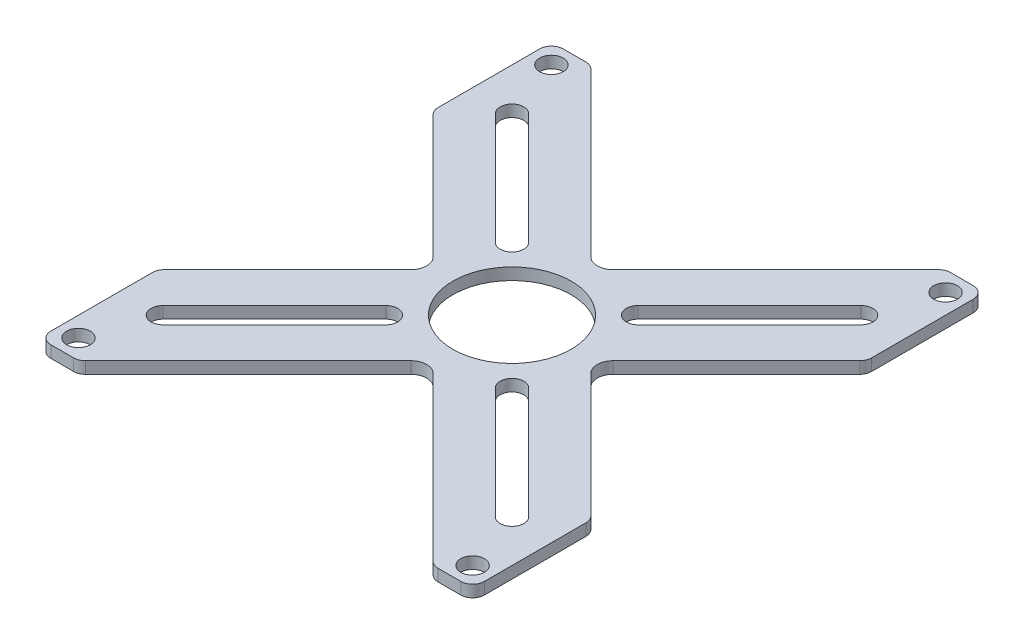
from build123d import *

# Parameters (mm, degrees)
SKETCH_1_W          = 55
SKETCH_1_H          = 65
SKETCH_1_R          = 1.5
EXTRUDE_1_DEPTH     = 1.5
CUT_EXTRUDE_1_DEPTH = 1.5
SKETCH_3_R          = 7.5
CUT_EXTRUDE_2_DEPTH = 43.599882629
FILLET_1_R          = 2
FILLET_2_R          = 1.5


with BuildPart() as part:
    # 草图1 → 凸台-拉伸1 (new body)
    with BuildSketch(Plane(origin=(0, 0, 0), x_dir=(1, 0, 0), z_dir=(0, 1, 0))):
        Rectangle(SKETCH_1_W, SKETCH_1_H)
        with Locations(Location((-25, 30, 0), (0, 0, 270))):
            Circle(SKETCH_1_R, mode=Mode.SUBTRACT)
        with Locations(Location((25, 30, 0), (0, 0, 270))):
            Circle(SKETCH_1_R, mode=Mode.SUBTRACT)
        with Locations(Location((25, -30, 0), (0, 0, 270))):
            Circle(SKETCH_1_R, mode=Mode.SUBTRACT)
        with Locations(Location((-25, -30, 0), (0, 0, 270))):
            Circle(SKETCH_1_R, mode=Mode.SUBTRACT)
    extrude(amount=EXTRUDE_1_DEPTH)

    # 草图2 → 切除-拉伸1 (cut)
    with BuildSketch(Plane(origin=(0, 1.5, 0), x_dir=(1, 0, 0), z_dir=(0, 1, 0))):
        with BuildLine():
            Line((-21.081475452, 23.202795796), (-6.939339828, 9.060660172))
            ThreePointArc((-6.939339828, 9.060660172), (-6.939339828, 6.939339828), (-9.060660172, 6.939339828))
            Line((-9.060660172, 6.939339828), (-23.202795796, 21.081475452))
            ThreePointArc((-23.202795796, 21.081475452), (-23.202795796, 23.202795796), (-21.081475452, 23.202795796))
        make_face()
        with BuildLine():
            Line((21.081475452, 23.202795796), (6.939339828, 9.060660172))
            ThreePointArc((6.939339828, 9.060660172), (6.939339828, 6.939339828), (9.060660172, 6.939339828))
            Line((9.060660172, 6.939339828), (23.202795796, 21.081475452))
            ThreePointArc((23.202795796, 21.081475452), (23.202795796, 23.202795796), (21.081475452, 23.202795796))
        make_face()
        with BuildLine():
            Line((23.202795796, -21.081475452), (9.060660172, -6.939339828))
            ThreePointArc((9.060660172, -6.939339828), (6.939339828, -6.939339828), (6.939339828, -9.060660172))
            Line((6.939339828, -9.060660172), (21.081475452, -23.202795796))
            ThreePointArc((21.081475452, -23.202795796), (23.202795796, -23.202795796), (23.202795796, -21.081475452))
        make_face()
        with BuildLine():
            Line((-21.081475452, -23.202795796), (-6.939339828, -9.060660172))
            ThreePointArc((-6.939339828, -9.060660172), (-6.939339828, -6.939339828), (-9.060660172, -6.939339828))
            Line((-9.060660172, -6.939339828), (-23.202795796, -21.081475452))
            ThreePointArc((-23.202795796, -21.081475452), (-23.202795796, -23.202795796), (-21.081475452, -23.202795796))
        make_face()
    extrude(amount=-CUT_EXTRUDE_1_DEPTH, mode=Mode.SUBTRACT)

    # 草图3 → 切除-拉伸2 (cut, through all)
    with BuildSketch(Plane(origin=(0, 1.5, 0), x_dir=(1, 0, 0), z_dir=(0, 1, 0))):
        with Locations(Location((0, 0, 0), (0, 0, 270))):
            Circle(SKETCH_3_R)
        Polygon((-22.5, 32.5), (0, 10), (22.5, 32.5), align=None)
        Polygon((-27.5, 17.5), (-10, 0), (-27.5, -17.5), align=None)
        Polygon((10, 0), (27.5, -17.5), (27.5, 17.5), align=None)
        Polygon((0, -10), (22.5, -32.5), (-22.5, -32.5), align=None)
    extrude(amount=-CUT_EXTRUDE_2_DEPTH, mode=Mode.SUBTRACT)

    # 圆角1
    fillet_1_edges = [part.edges().sort_by_distance(p)[0] for p in [
        (-10, 0.75, 0),
        (10, 0.75, 0),
        (0, 0.75, 10),
        (0, 0.75, -10),
    ]]
    fillet(fillet_1_edges, radius=FILLET_1_R)

    # 圆角2
    fillet_2_edges = [part.edges().sort_by_distance(p)[0] for p in [
        (-27.5, 0.75, 17.5),
        (-27.5, 0.75, -17.5),
        (27.5, 0.75, -17.5),
        (27.5, 0.75, 17.5),
        (-22.5, 0.75, 32.5),
        (22.5, 0.75, 32.5),
        (-22.5, 0.75, -32.5),
        (22.5, 0.75, -32.5),
        (27.5, 0.75, 32.5),
        (-27.5, 0.75, 32.5),
        (-27.5, 0.75, -32.5),
        (27.5, 0.75, -32.5),
    ]]
    fillet(fillet_2_edges, radius=FILLET_2_R)


solid = part.part
